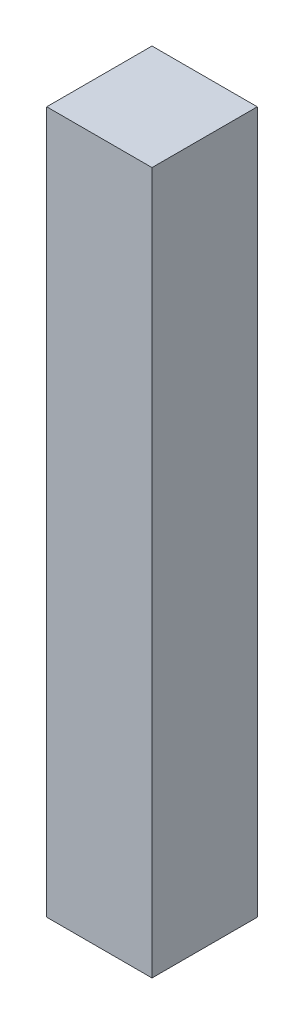
from build123d import *

# Parameters (mm, degrees)
SKETCH1_W           = 15
SKETCH1_H           = 15
BOSS_EXTRUDE1_DEPTH = 100


with BuildPart() as part:
    # Sketch1 → Boss-Extrude1 (new body)
    with BuildSketch(Plane(origin=(0, 0, 0), x_dir=(1, 0, 0), z_dir=(0, 1, 0))):
        Rectangle(SKETCH1_W, SKETCH1_H)
    extrude(amount=BOSS_EXTRUDE1_DEPTH)


solid = part.part
